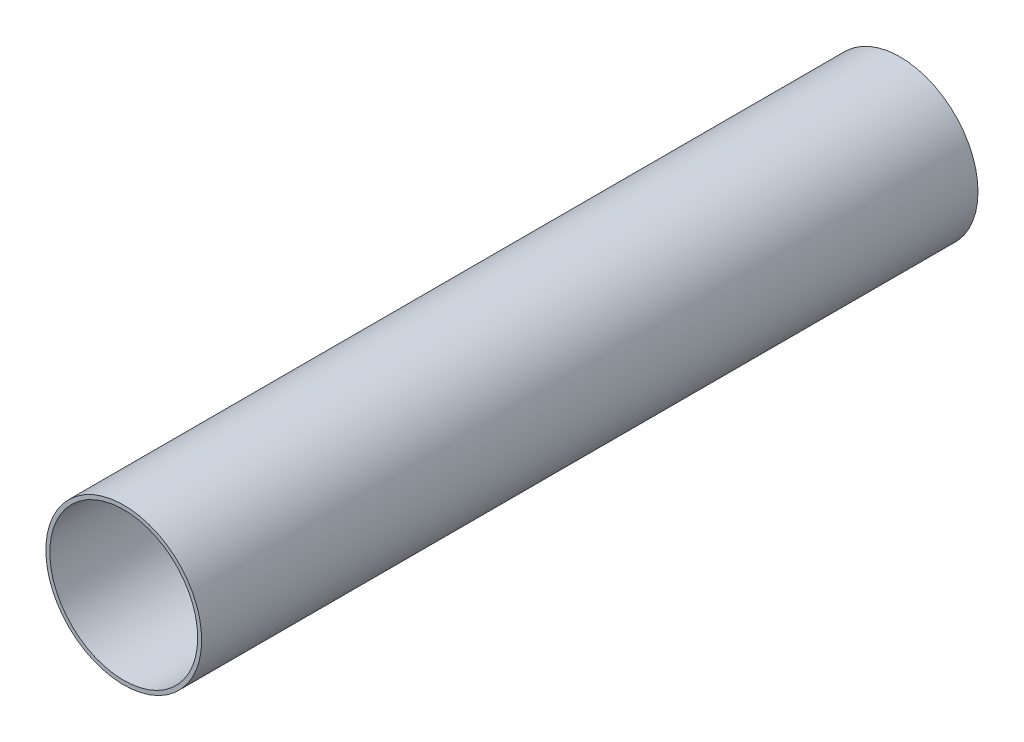
from build123d import *

# Parameters (mm, degrees)
SKETCH1_R           = 53.5305
SKETCH1_R_2         = 50.8
BOSS_EXTRUDE1_DEPTH = 533.4


with BuildPart() as part:
    # Sketch1 → Boss-Extrude1 (new body)
    with BuildSketch(Plane.XY):
        Circle(SKETCH1_R)
        Circle(SKETCH1_R_2, mode=Mode.SUBTRACT)
    extrude(amount=BOSS_EXTRUDE1_DEPTH)


solid = part.part
